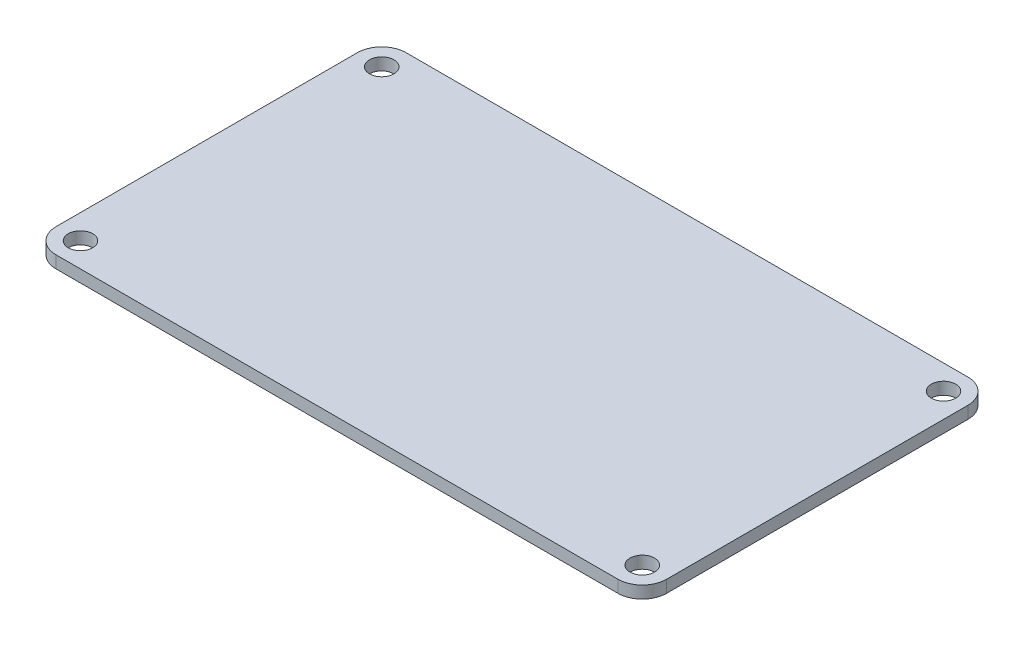
from build123d import *

# Parameters (mm, degrees)
SKETCH1_R           = 1.5
BOSS_EXTRUDE1_DEPTH = 1.5


with BuildPart() as part:
    # Sketch1 → Boss-Extrude1 (new body)
    with BuildSketch(Plane(origin=(0, 0, 0), x_dir=(1, 0, 0), z_dir=(0, 1, 0))):
        with BuildLine():
            Line((34.5, -21.5), (-34.5, -21.5))
            ThreePointArc((-34.5, -21.5), (-36.621320344, -20.621320344), (-37.5, -18.5))
            Line((-37.5, -18.5), (-37.5, 18.5))
            ThreePointArc((-37.5, 18.5), (-36.621320344, 20.621320344), (-34.5, 21.5))
            Line((-34.5, 21.5), (34.5, 21.5))
            ThreePointArc((34.5, 21.5), (36.621320344, 20.621320344), (37.5, 18.5))
            Line((37.5, 18.5), (37.5, -18.5))
            ThreePointArc((37.5, -18.5), (36.621320344, -20.621320344), (34.5, -21.5))
        make_face()
        with Locations(Location((-34.5, 18.5, 0), (0, 0, 270))):
            Circle(SKETCH1_R, mode=Mode.SUBTRACT)
        with Locations(Location((34.5, 18.5, 0), (0, 0, 270))):
            Circle(SKETCH1_R, mode=Mode.SUBTRACT)
        with Locations(Location((-34.5, -18.5, 0), (0, 0, 270))):
            Circle(SKETCH1_R, mode=Mode.SUBTRACT)
        with Locations(Location((34.5, -18.5, 0), (0, 0, 270))):
            Circle(SKETCH1_R, mode=Mode.SUBTRACT)
    extrude(amount=BOSS_EXTRUDE1_DEPTH)


solid = part.part
